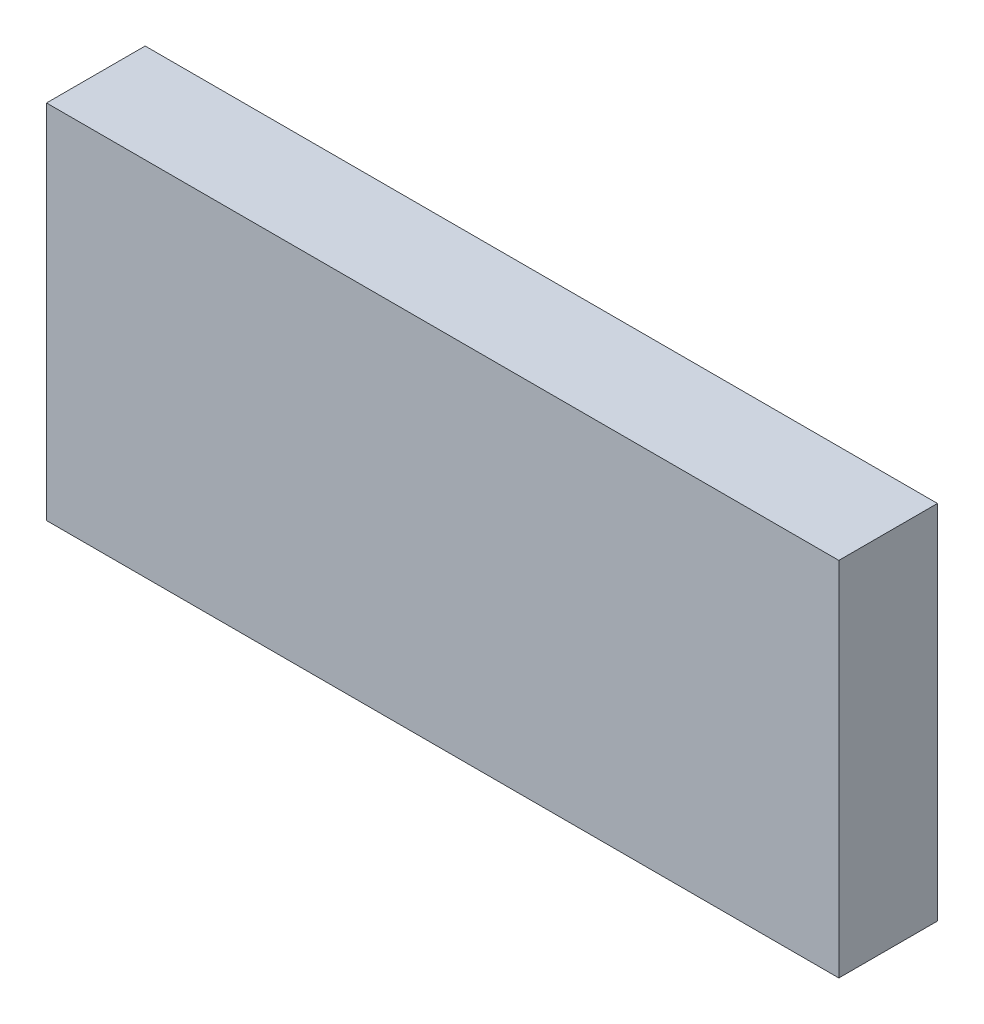
from build123d import *

# Parameters (mm, degrees)
SKETCH1_W           = 306.04968
SKETCH1_H           = 139.7
BOSS_EXTRUDE1_DEPTH = 38.1


with BuildPart() as part:
    # Sketch1 → Boss-Extrude1 (new body)
    with BuildSketch(Plane.XY):
        Rectangle(SKETCH1_W, SKETCH1_H)
    extrude(amount=-BOSS_EXTRUDE1_DEPTH)


solid = part.part
